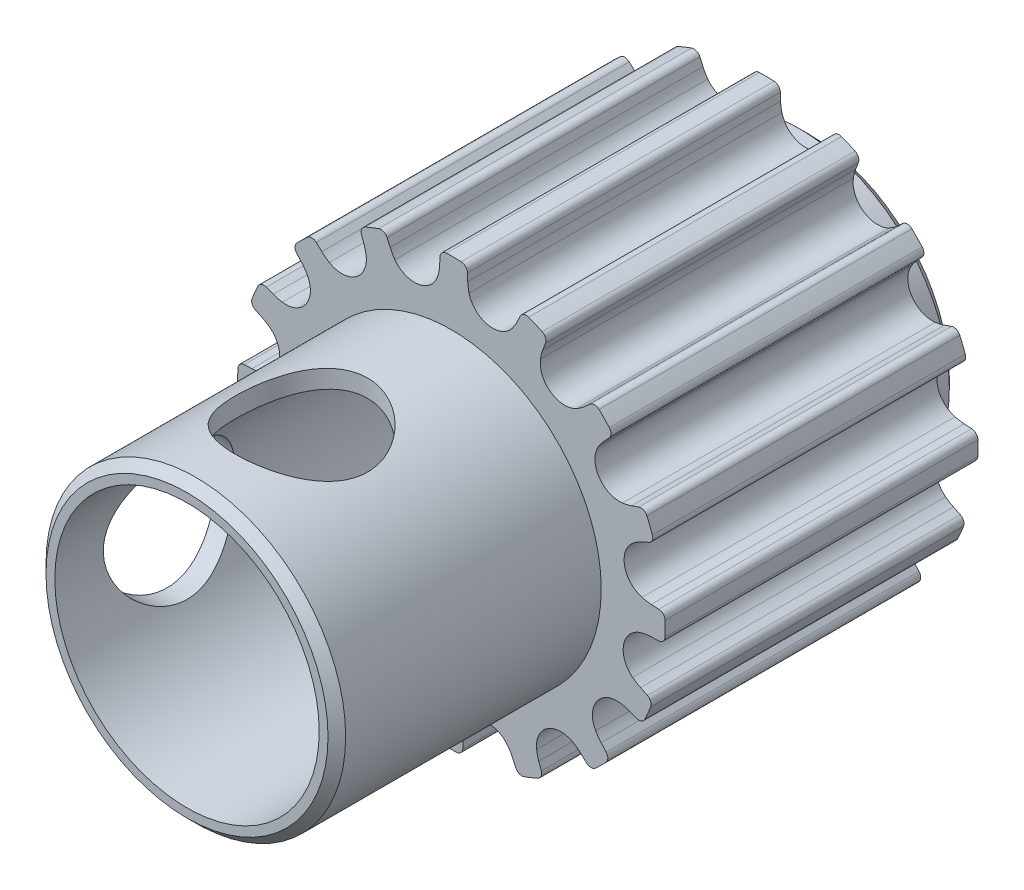
from build123d import *

# Parameters (mm, degrees)
SKETCH1_R         = 3.4
EXTRUDE1_DEPTH    = 1
SKETCH2_R         = 4.9
EXTRUDE2_DEPTH    = 7.1
SKETCH3_R         = 3.4
EXTRUDE3_DEPTH    = 6
SKETCH4_R         = 3
EXTRUDE4_DEPTH    = 16.710824294
SKETCH5_OUTSIDE_W = 15.754
SKETCH5_OUTSIDE_H = 15.754
EXTRUDE5_DEPTH    = 11.659737333
SKETCH6_R         = 1.5
EXTRUDE6_DEPTH    = 16.679764029
CIRPATTERN1_COUNT = 2
CIRPATTERN1_ANGLE = 90
CHAMFER1_SIZE     = 0.2


with BuildPart() as part:
    # Sketch1 → Extrude1 (new body)
    with BuildSketch(Plane.XY):
        Circle(SKETCH1_R)
    extrude(amount=EXTRUDE1_DEPTH)

    # Sketch2 → Extrude2 (add)
    with BuildSketch(Plane.XY.offset(1)):
        Circle(SKETCH2_R)
    extrude(amount=EXTRUDE2_DEPTH)

    # Sketch3 → Extrude3 (add)
    with BuildSketch(Plane.XY.offset(8.1)):
        Circle(SKETCH3_R)
    extrude(amount=EXTRUDE3_DEPTH)

    # Sketch4 → Extrude4 (cut, through all)
    with BuildSketch(Plane.XY.offset(14.1)):
        Circle(SKETCH4_R)
    extrude(amount=-EXTRUDE4_DEPTH, mode=Mode.SUBTRACT)

    # Sketch5 outside → Extrude5 (cut, through all)
    with BuildSketch(Plane.XY.offset(8.1)):
        Rectangle(SKETCH5_OUTSIDE_W, SKETCH5_OUTSIDE_H)
        with BuildLine():
            Line((1.488058694, 4.292367714), (1.562845865, 4.44764847))
            ThreePointArc((1.562845865, 4.44764847), (1.64288561, 4.522072588), (1.75217963, 4.522429275))
            ThreePointArc((1.75217963, 4.522429275), (1.906642513, 4.459508306), (2.05885059, 4.391313499))
            ThreePointArc((2.05885059, 4.391313499), (2.13410505, 4.312053948), (2.135601068, 4.202769585))
            Line((2.135601068, 4.202769585), (2.075013464, 4.041417869))
            ThreePointArc((2.075013464, 4.041417869), (2.043020951, 3.940186555), (2.021940946, 3.836134004))
            ThreePointArc((2.021940946, 3.836134004), (2.257425417, 3.297021243), (2.845210982, 3.272452254))
            ThreePointArc((2.845210982, 3.272452254), (2.934596424, 3.329737005), (3.01740498, 3.396175268))
            Line((3.01740498, 3.396175268), (3.14592269, 3.511016169))
            ThreePointArc((3.14592269, 3.511016169), (3.248350649, 3.549145204), (3.349461655, 3.507649729))
            ThreePointArc((3.349461655, 3.507649729), (3.468087938, 3.390407948), (3.582612843, 3.269156652))
            ThreePointArc((3.582612843, 3.269156652), (3.621807581, 3.167131741), (3.581368407, 3.065593653))
            Line((3.581368407, 3.065593653), (3.463646131, 2.939709977))
            ThreePointArc((3.463646131, 2.939709977), (3.395349356, 2.858427442), (3.336054784, 2.770362389))
            ThreePointArc((3.336054784, 2.770362389), (3.347304545, 2.182171138), (3.880945453, 1.934536554))
            ThreePointArc((3.880945453, 1.934536554), (3.985448758, 1.953254436), (4.087378711, 1.982945924))
            Line((4.087378711, 1.982945924), (4.250061303, 2.039863484))
            ThreePointArc((4.250061303, 2.039863484), (4.359283747, 2.035892637), (4.436818506, 1.958862309))
            ThreePointArc((4.436818506, 1.958862309), (4.501548414, 1.805148714), (4.560954767, 1.64930034))
            ThreePointArc((4.560954767, 1.64930034), (4.55812274, 1.540042435), (4.481904871, 1.461708876))
            Line((4.481904871, 1.461708876), (4.324970072, 1.390457889))
            ThreePointArc((4.324970072, 1.390457889), (4.230766601, 1.341498663), (4.142284522, 1.282828214))
            ThreePointArc((4.142284522, 1.282828214), (3.927586899, 0.735105258), (4.325841159, 0.302105201))
            ThreePointArc((4.325841159, 0.302105201), (4.429552647, 0.279406585), (4.535086085, 0.267831039))
            Line((4.535086085, 0.267831039), (4.707166609, 0.258160075))
            ThreePointArc((4.707166609, 0.258160075), (4.806555413, 0.21269387), (4.848709959, 0.11185586))
            ThreePointArc((4.848709959, 0.11185586), (4.84968895, -0.054928048), (4.844932673, -0.221646998))
            ThreePointArc((4.844932673, -0.221646998), (4.800505032, -0.32150437), (4.700111947, -0.364707826))
            Line((4.700111947, -0.364707826), (4.527856526, -0.370478807))
            ThreePointArc((4.527856526, -0.370478807), (4.422087982, -0.379661126), (4.317888992, -0.400004928))
            ThreePointArc((4.317888992, -0.400004928), (3.909929752, -0.823873733), (4.112166763, -1.376318931))
            ThreePointArc((4.112166763, -1.376318931), (4.1992973, -1.436978386), (4.292367714, -1.488058694))
            Line((4.292367714, -1.488058694), (4.44764847, -1.562845865))
            ThreePointArc((4.44764847, -1.562845865), (4.522072588, -1.64288561), (4.522429275, -1.75217963))
            ThreePointArc((4.522429275, -1.75217963), (4.459508306, -1.906642513), (4.391313499, -2.05885059))
            ThreePointArc((4.391313499, -2.05885059), (4.312053948, -2.13410505), (4.202769585, -2.135601068))
            Line((4.202769585, -2.135601068), (4.041417869, -2.075013464))
            ThreePointArc((4.041417869, -2.075013464), (3.940186555, -2.043020951), (3.836134004, -2.021940946))
            ThreePointArc((3.836134004, -2.021940946), (3.297021243, -2.257425417), (3.272452254, -2.845210982))
            ThreePointArc((3.272452254, -2.845210982), (3.329737005, -2.934596424), (3.396175268, -3.01740498))
            Line((3.396175268, -3.01740498), (3.511016169, -3.14592269))
            ThreePointArc((3.511016169, -3.14592269), (3.549145204, -3.248350649), (3.507649729, -3.349461655))
            ThreePointArc((3.507649729, -3.349461655), (3.390407948, -3.468087938), (3.269156652, -3.582612843))
            ThreePointArc((3.269156652, -3.582612843), (3.167131741, -3.621807581), (3.065593653, -3.581368407))
            Line((3.065593653, -3.581368407), (2.939709977, -3.463646131))
            ThreePointArc((2.939709977, -3.463646131), (2.858427442, -3.395349356), (2.770362389, -3.336054784))
            ThreePointArc((2.770362389, -3.336054784), (2.182171138, -3.347304545), (1.934536554, -3.880945453))
            ThreePointArc((1.934536554, -3.880945453), (1.953254436, -3.985448758), (1.982945924, -4.087378711))
            Line((1.982945924, -4.087378711), (2.039863484, -4.250061303))
            ThreePointArc((2.039863484, -4.250061303), (2.035892637, -4.359283747), (1.958862309, -4.436818506))
            ThreePointArc((1.958862309, -4.436818506), (1.805148714, -4.501548414), (1.64930034, -4.560954767))
            ThreePointArc((1.64930034, -4.560954767), (1.540042435, -4.55812274), (1.461708876, -4.481904871))
            Line((1.461708876, -4.481904871), (1.390457889, -4.324970072))
            ThreePointArc((1.390457889, -4.324970072), (1.341498663, -4.230766601), (1.282828214, -4.142284522))
            ThreePointArc((1.282828214, -4.142284522), (0.735105258, -3.927586899), (0.302105201, -4.325841159))
            ThreePointArc((0.302105201, -4.325841159), (0.279406585, -4.429552647), (0.267831039, -4.535086085))
            Line((0.267831039, -4.535086085), (0.258160075, -4.707166609))
            ThreePointArc((0.258160075, -4.707166609), (0.21269387, -4.806555413), (0.11185586, -4.848709959))
            ThreePointArc((0.11185586, -4.848709959), (-0.054928048, -4.84968895), (-0.221646998, -4.844932673))
            ThreePointArc((-0.221646998, -4.844932673), (-0.32150437, -4.800505032), (-0.364707826, -4.700111947))
            Line((-0.364707826, -4.700111947), (-0.370478807, -4.527856526))
            ThreePointArc((-0.370478807, -4.527856526), (-0.379661126, -4.422087982), (-0.400004928, -4.317888992))
            ThreePointArc((-0.400004928, -4.317888992), (-0.823873733, -3.909929752), (-1.376318931, -4.112166763))
            ThreePointArc((-1.376318931, -4.112166763), (-1.436978386, -4.1992973), (-1.488058694, -4.292367714))
            Line((-1.488058694, -4.292367714), (-1.562845865, -4.44764847))
            ThreePointArc((-1.562845865, -4.44764847), (-1.64288561, -4.522072588), (-1.75217963, -4.522429275))
            ThreePointArc((-1.75217963, -4.522429275), (-1.906642513, -4.459508306), (-2.05885059, -4.391313499))
            ThreePointArc((-2.05885059, -4.391313499), (-2.13410505, -4.312053948), (-2.135601068, -4.202769585))
            Line((-2.135601068, -4.202769585), (-2.075013464, -4.041417869))
            ThreePointArc((-2.075013464, -4.041417869), (-2.043020951, -3.940186555), (-2.021940946, -3.836134004))
            ThreePointArc((-2.021940946, -3.836134004), (-2.257425417, -3.297021243), (-2.845210982, -3.272452254))
            ThreePointArc((-2.845210982, -3.272452254), (-2.934596424, -3.329737005), (-3.01740498, -3.396175268))
            Line((-3.01740498, -3.396175268), (-3.14592269, -3.511016169))
            ThreePointArc((-3.14592269, -3.511016169), (-3.248350649, -3.549145204), (-3.349461655, -3.507649729))
            ThreePointArc((-3.349461655, -3.507649729), (-3.468087938, -3.390407948), (-3.582612843, -3.269156652))
            ThreePointArc((-3.582612843, -3.269156652), (-3.621807581, -3.167131741), (-3.581368407, -3.065593653))
            Line((-3.581368407, -3.065593653), (-3.463646131, -2.939709977))
            ThreePointArc((-3.463646131, -2.939709977), (-3.395349356, -2.858427442), (-3.336054784, -2.770362389))
            ThreePointArc((-3.336054784, -2.770362389), (-3.347304545, -2.182171138), (-3.880945453, -1.934536554))
            ThreePointArc((-3.880945453, -1.934536554), (-3.985448758, -1.953254436), (-4.087378711, -1.982945924))
            Line((-4.087378711, -1.982945924), (-4.250061303, -2.039863484))
            ThreePointArc((-4.250061303, -2.039863484), (-4.359283747, -2.035892637), (-4.436818506, -1.958862309))
            ThreePointArc((-4.436818506, -1.958862309), (-4.501548414, -1.805148714), (-4.560954767, -1.64930034))
            ThreePointArc((-4.560954767, -1.64930034), (-4.55812274, -1.540042435), (-4.481904871, -1.461708876))
            Line((-4.481904871, -1.461708876), (-4.324970072, -1.390457889))
            ThreePointArc((-4.324970072, -1.390457889), (-4.230766601, -1.341498663), (-4.142284522, -1.282828214))
            ThreePointArc((-4.142284522, -1.282828214), (-3.927586899, -0.735105258), (-4.325841159, -0.302105201))
            ThreePointArc((-4.325841159, -0.302105201), (-4.429552647, -0.279406585), (-4.535086085, -0.267831039))
            Line((-4.535086085, -0.267831039), (-4.707166609, -0.258160075))
            ThreePointArc((-4.707166609, -0.258160075), (-4.806555413, -0.21269387), (-4.848709959, -0.11185586))
            ThreePointArc((-4.848709959, -0.11185586), (-4.84968895, 0.054928048), (-4.844932673, 0.221646998))
            ThreePointArc((-4.844932673, 0.221646998), (-4.800505032, 0.32150437), (-4.700111947, 0.364707826))
            Line((-4.700111947, 0.364707826), (-4.527856526, 0.370478807))
            ThreePointArc((-4.527856526, 0.370478807), (-4.422087982, 0.379661126), (-4.317888992, 0.400004928))
            ThreePointArc((-4.317888992, 0.400004928), (-3.909929752, 0.823873733), (-4.112166763, 1.376318931))
            ThreePointArc((-4.112166763, 1.376318931), (-4.1992973, 1.436978386), (-4.292367714, 1.488058694))
            Line((-4.292367714, 1.488058694), (-4.44764847, 1.562845865))
            ThreePointArc((-4.44764847, 1.562845865), (-4.522072588, 1.64288561), (-4.522429275, 1.75217963))
            ThreePointArc((-4.522429275, 1.75217963), (-4.459508306, 1.906642513), (-4.391313499, 2.05885059))
            ThreePointArc((-4.391313499, 2.05885059), (-4.312053948, 2.13410505), (-4.202769585, 2.135601068))
            Line((-4.202769585, 2.135601068), (-4.041417869, 2.075013464))
            ThreePointArc((-4.041417869, 2.075013464), (-3.940186555, 2.043020951), (-3.836134004, 2.021940946))
            ThreePointArc((-3.836134004, 2.021940946), (-3.297021243, 2.257425417), (-3.272452254, 2.845210982))
            ThreePointArc((-3.272452254, 2.845210982), (-3.329737005, 2.934596424), (-3.396175268, 3.01740498))
            Line((-3.396175268, 3.01740498), (-3.511016169, 3.14592269))
            ThreePointArc((-3.511016169, 3.14592269), (-3.549145204, 3.248350649), (-3.507649729, 3.349461655))
            ThreePointArc((-3.507649729, 3.349461655), (-3.390407948, 3.468087938), (-3.269156652, 3.582612843))
            ThreePointArc((-3.269156652, 3.582612843), (-3.167131741, 3.621807581), (-3.065593653, 3.581368407))
            Line((-3.065593653, 3.581368407), (-2.939709977, 3.463646131))
            ThreePointArc((-2.939709977, 3.463646131), (-2.858427442, 3.395349356), (-2.770362389, 3.336054784))
            ThreePointArc((-2.770362389, 3.336054784), (-2.182171138, 3.347304545), (-1.934536554, 3.880945453))
            ThreePointArc((-1.934536554, 3.880945453), (-1.953254436, 3.985448758), (-1.982945924, 4.087378711))
            Line((-1.982945924, 4.087378711), (-2.039863484, 4.250061303))
            ThreePointArc((-2.039863484, 4.250061303), (-2.035892637, 4.359283747), (-1.958862309, 4.436818506))
            ThreePointArc((-1.958862309, 4.436818506), (-1.805148714, 4.501548414), (-1.64930034, 4.560954767))
            ThreePointArc((-1.64930034, 4.560954767), (-1.540042435, 4.55812274), (-1.461708876, 4.481904871))
            Line((-1.461708876, 4.481904871), (-1.390457889, 4.324970072))
            ThreePointArc((-1.390457889, 4.324970072), (-1.341840724, 4.227066866), (-1.282828214, 4.135054963))
            ThreePointArc((-1.282828214, 4.135054963), (-0.735105258, 3.92035734), (-0.302105201, 4.3186116))
            ThreePointArc((-0.302105201, 4.3186116), (-0.279406585, 4.422323088), (-0.267831039, 4.527856526))
            Line((-0.267831039, 4.527856526), (-0.2583916, 4.699949905))
            ThreePointArc((-0.2583916, 4.699949905), (-0.215258328, 4.804013947), (-0.11185586, 4.848709959))
            ThreePointArc((-0.11185586, 4.848709959), (0.054928048, 4.84968895), (0.221646998, 4.844932673))
            ThreePointArc((0.221646998, 4.844932673), (0.32150437, 4.800505032), (0.364707826, 4.700111947))
            Line((0.364707826, 4.700111947), (0.370478807, 4.527856526))
            ThreePointArc((0.370478807, 4.527856526), (0.379661126, 4.422087982), (0.400004928, 4.317888992))
            ThreePointArc((0.400004928, 4.317888992), (0.823873733, 3.909929752), (1.376318931, 4.112166763))
            ThreePointArc((1.376318931, 4.112166763), (1.436978386, 4.1992973), (1.488058694, 4.292367714))
        make_face(mode=Mode.SUBTRACT)
    extrude(amount=-EXTRUDE5_DEPTH, mode=Mode.SUBTRACT)

    # Sketch6 → Extrude6 (cut, through all)
    with BuildSketch(Plane(origin=(0, 0, 0), x_dir=(1, 0, 0), z_dir=(0, 1, 0))):
        with Locations(Location((0, -11.5, 0), (0, 0, 90))):
            Circle(SKETCH6_R)
    extrude6 = extrude(amount=EXTRUDE6_DEPTH, mode=Mode.SUBTRACT)

    # CirPattern1: Extrude6 ×2 about axis
    cirpattern1_axis = Axis((0, 0, 14.1), (0, 0, 1))
    for i in range(1, CIRPATTERN1_COUNT):
        add(extrude6.rotate(cirpattern1_axis, i * CIRPATTERN1_ANGLE / (CIRPATTERN1_COUNT - 1)), mode=Mode.SUBTRACT)

    # Chamfer1
    chamfer1_edges = [part.edges().sort_by_distance(p)[0] for p in [
        (-3.4, 0, 14.1),
        (-3.4, 0, 0),
    ]]
    chamfer(chamfer1_edges, length=CHAMFER1_SIZE)


solid = part.part
